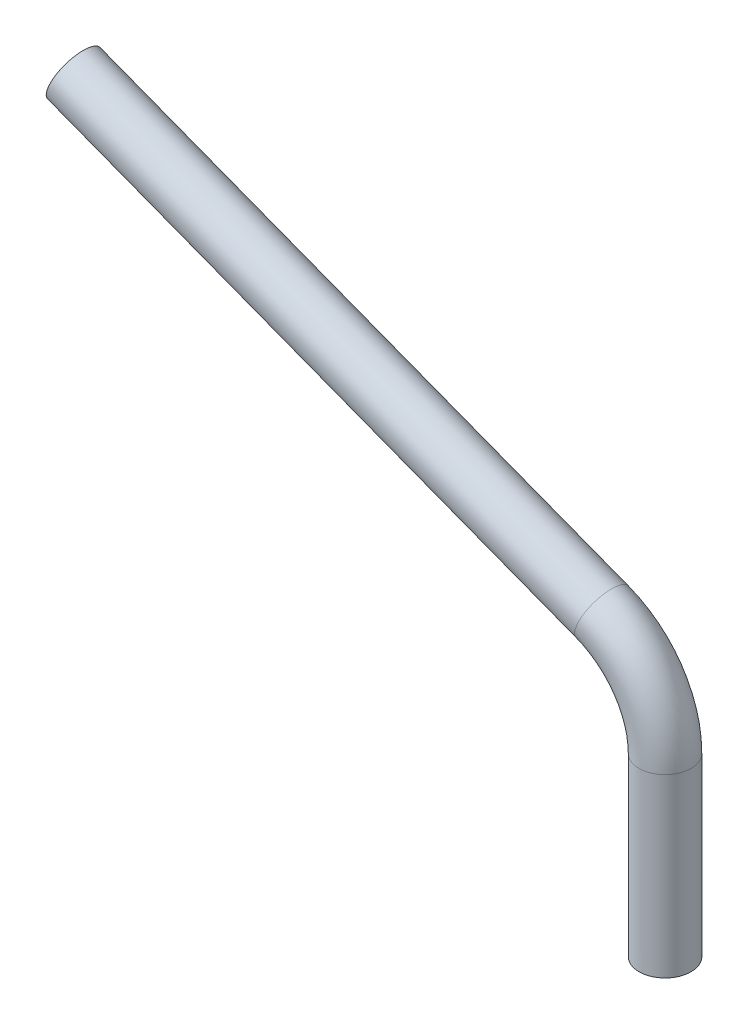
from build123d import *

# Parameters (mm, degrees)
SKETCH2_R = 1.5748


with BuildPart() as part:
    # Sweep1: sweep along a path in Sketch1
    with BuildLine(Plane.XY) as sweep1_path:
        Line((-35.814, 28.448), (-3.81, 16.204798039))
        ThreePointArc((-3.81, 16.204798039), (-1.044521212, 14.028514564), (0, 10.668))
        Line((0, 10.668), (0, 0))
    # Sketch2 → Sweep1 (sweep)
    with BuildSketch(Plane(origin=(0, 0, 0), x_dir=(1, 0, 0), z_dir=(0, 1, 0))):
        Circle(SKETCH2_R)
    sweep(path=sweep1_path.line)


solid = part.part
